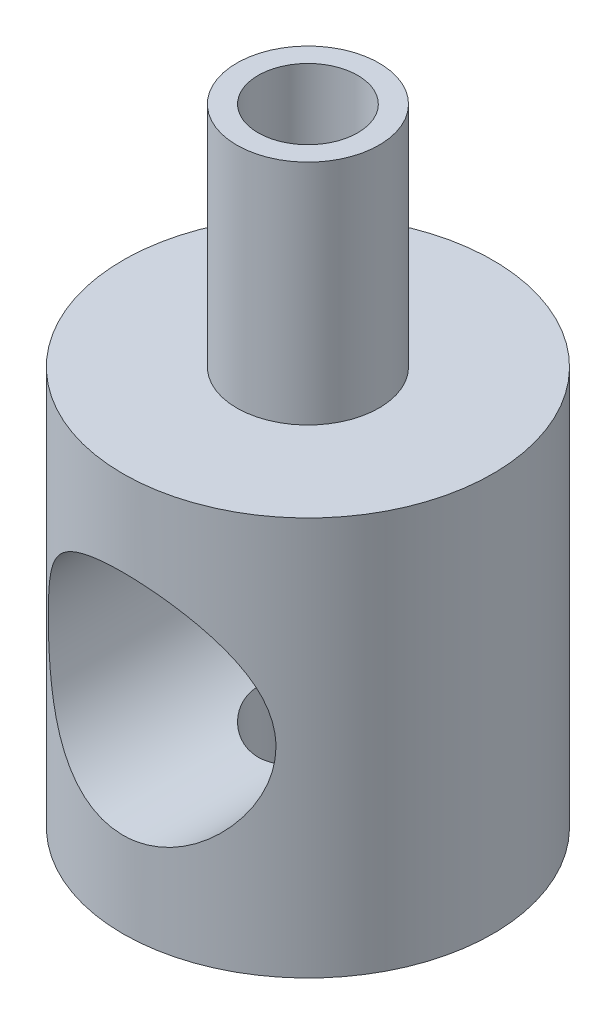
from build123d import *

# Parameters (mm, degrees)
SKETCH1_R               = 6.5
BOSS_EXTRUDE1_DEPTH     = 14
SKETCH2_R               = 2.5
BOSS_EXTRUDE2_DEPTH     = 8
CUT_EXTRUDE1_DEPTH      = 24.843238035
CUT_EXTRUDE1_DEPTH_BACK = 24.843238035
SKETCH3_R               = 4
SKETCH4_R               = 1.75
CUT_EXTRUDE2_DEPTH      = 24.843238184


with BuildPart() as part:
    # Sketch1 → Boss-Extrude1 (new body)
    with BuildSketch(Plane(origin=(0, 0, 0), x_dir=(1, 0, 0), z_dir=(0, 1, 0))):
        with Locations(Location((0, 0, 0), (0, 0, 270))):
            Circle(SKETCH1_R)
    extrude(amount=BOSS_EXTRUDE1_DEPTH)

    # Sketch2 → Boss-Extrude2 (add)
    with BuildSketch(Plane(origin=(0, 14, 0), x_dir=(1, 0, 0), z_dir=(0, 1, 0))):
        with Locations(Location((0, 0, 0), (0, 0, 270))):
            Circle(SKETCH2_R)
    extrude(amount=BOSS_EXTRUDE2_DEPTH)

    # Sketch3 → Cut-Extrude1 (cut, two sides: drawn at the far end of the back side and taken through both)
    with BuildSketch(Plane.XY.offset(-CUT_EXTRUDE1_DEPTH_BACK)):
        with Locations(Location((0, 7, 0), (0, 0, 90))):
            Circle(SKETCH3_R)
    extrude(amount=CUT_EXTRUDE1_DEPTH + CUT_EXTRUDE1_DEPTH_BACK, mode=Mode.SUBTRACT)

    # Sketch4 → Cut-Extrude2 (cut, through all)
    with BuildSketch(Plane(origin=(0, 22, 0), x_dir=(1, 0, 0), z_dir=(0, 1, 0))):
        with Locations(Location((0, 0, 0), (0, 0, 270))):
            Circle(SKETCH4_R)
    extrude(amount=-CUT_EXTRUDE2_DEPTH, mode=Mode.SUBTRACT)


solid = part.part
